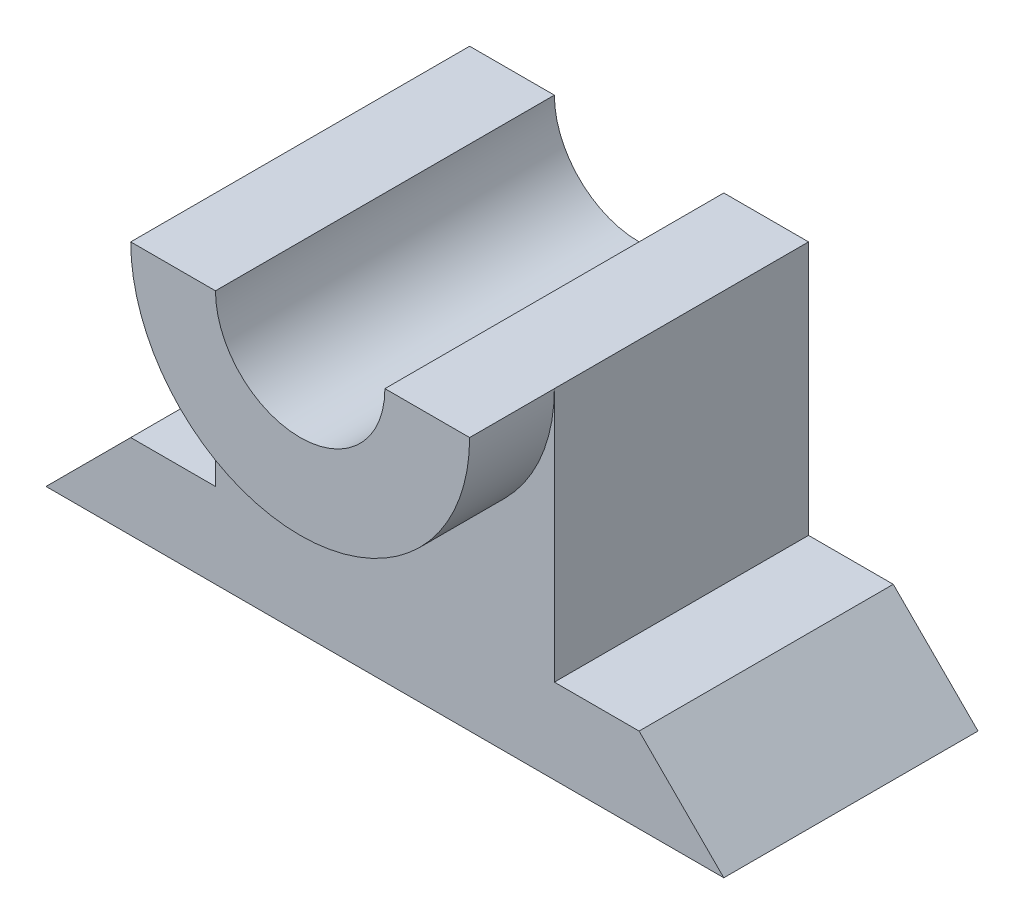
from build123d import *

# Parameters (mm, degrees)
BOSS_EXTRUDE1_DEPTH = 30
BOSS_EXTRUDE2_DEPTH = 10


with BuildPart() as part:
    # Sketch1 → Boss-Extrude1 (new body)
    with BuildSketch(Plane.XY):
        with BuildLine():
            Line((-40, 0), (40, 0))
            Line((40, 0), (30, 10))
            Line((30, 10), (20, 10))
            Line((20, 10), (20, 40))
            Line((20, 40), (10, 40))
            ThreePointArc((10, 40), (0, 30), (-10, 40))
            Line((-10, 40), (-20, 40))
            Line((-20, 40), (-20, 10))
            Line((-20, 10), (-30, 10))
            Line((-30, 10), (-40, 0))
        make_face()
    extrude(amount=BOSS_EXTRUDE1_DEPTH)

    # Sketch3 → Boss-Extrude2 (add)
    with BuildSketch(Plane.XY.offset(30)):
        with BuildLine():
            ThreePointArc((20, 40), (0, 20), (-20, 40))
            Line((-20, 40), (-10, 40))
            ThreePointArc((-10, 40), (0, 30), (10, 40))
            Line((10, 40), (20, 40))
        make_face()
    extrude(amount=BOSS_EXTRUDE2_DEPTH)


solid = part.part
